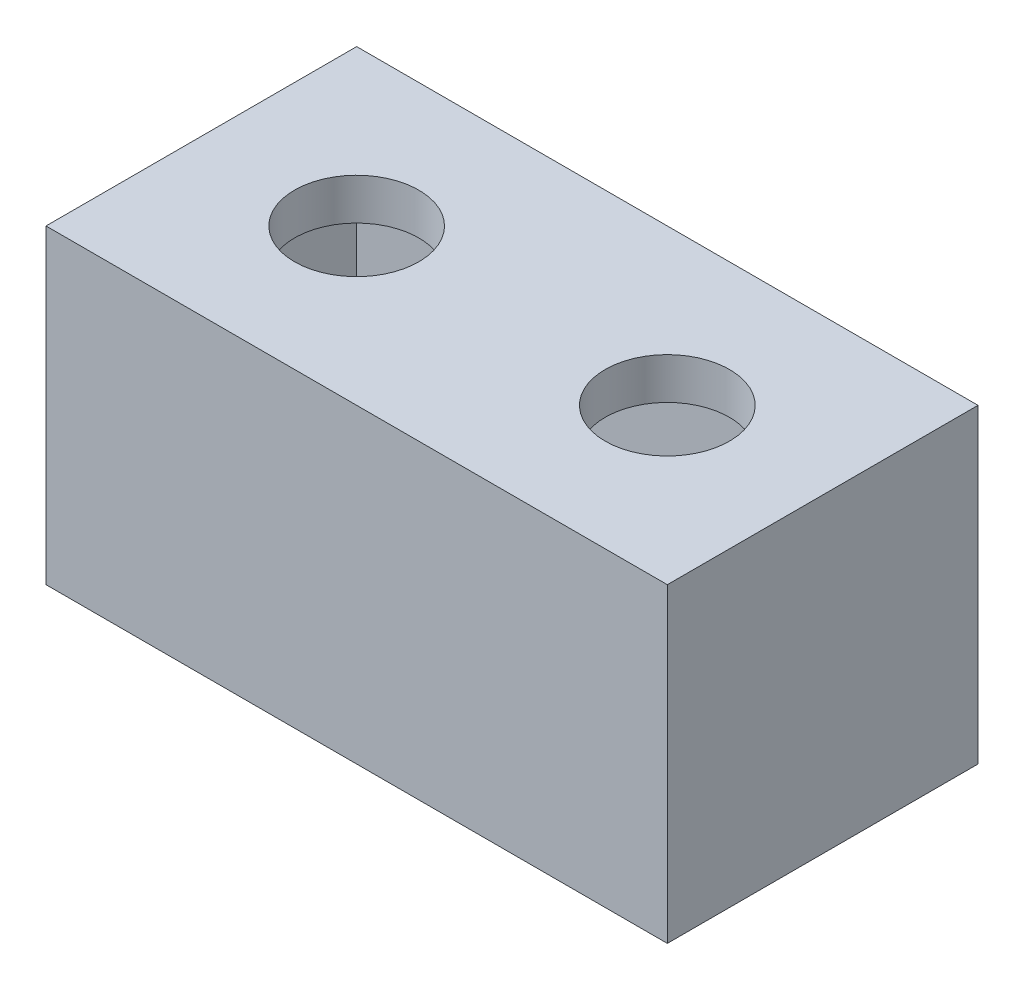
from build123d import *

# Parameters (mm, degrees)
SKETCH1_W           = 30
SKETCH1_H           = 15
BOSS_EXTRUDE1_DEPTH = 15
SKETCH2_W           = 26
SKETCH2_H           = 11
CUT_EXTRUDE1_DEPTH  = 13
SKETCH3_R           = 3
CUT_EXTRUDE2_DEPTH  = 13
SKETCH4_R           = 5
CUT_EXTRUDE3_DEPTH  = 5


with BuildPart() as part:
    # Sketch1 → Boss-Extrude1 (new body)
    with BuildSketch(Plane(origin=(0, 0, 0), x_dir=(1, 0, 0), z_dir=(0, 1, 0))):
        with Locations((15, 7.5)):
            Rectangle(SKETCH1_W, SKETCH1_H)
    extrude(amount=BOSS_EXTRUDE1_DEPTH)

    # Sketch2 → Cut-Extrude1 (cut)
    with BuildSketch(Plane.XZ):
        with Locations((15, -7.5)):
            Rectangle(SKETCH2_W, SKETCH2_H)
    extrude(amount=-CUT_EXTRUDE1_DEPTH, mode=Mode.SUBTRACT)

    # Sketch3 → Cut-Extrude2 (cut)
    with BuildSketch(Plane(origin=(0, 15, 0), x_dir=(1, 0, 0), z_dir=(0, 1, 0))):
        with Locations(Location((7.5, 7.5, 0), (0, 0, 270))):
            Circle(SKETCH3_R)
        with Locations(Location((22.5, 7.5, 0), (0, 0, 270))):
            Circle(SKETCH3_R)
    extrude(amount=-CUT_EXTRUDE2_DEPTH, mode=Mode.SUBTRACT)

    # Sketch4 → Cut-Extrude3 (cut)
    with BuildSketch(Plane(origin=(0, 0, -15), x_dir=(-1, 0, 0), z_dir=(0, 0, -1))):
        with Locations((-15, 0)):
            Circle(SKETCH4_R)
    extrude(amount=-CUT_EXTRUDE3_DEPTH, mode=Mode.SUBTRACT)


solid = part.part
